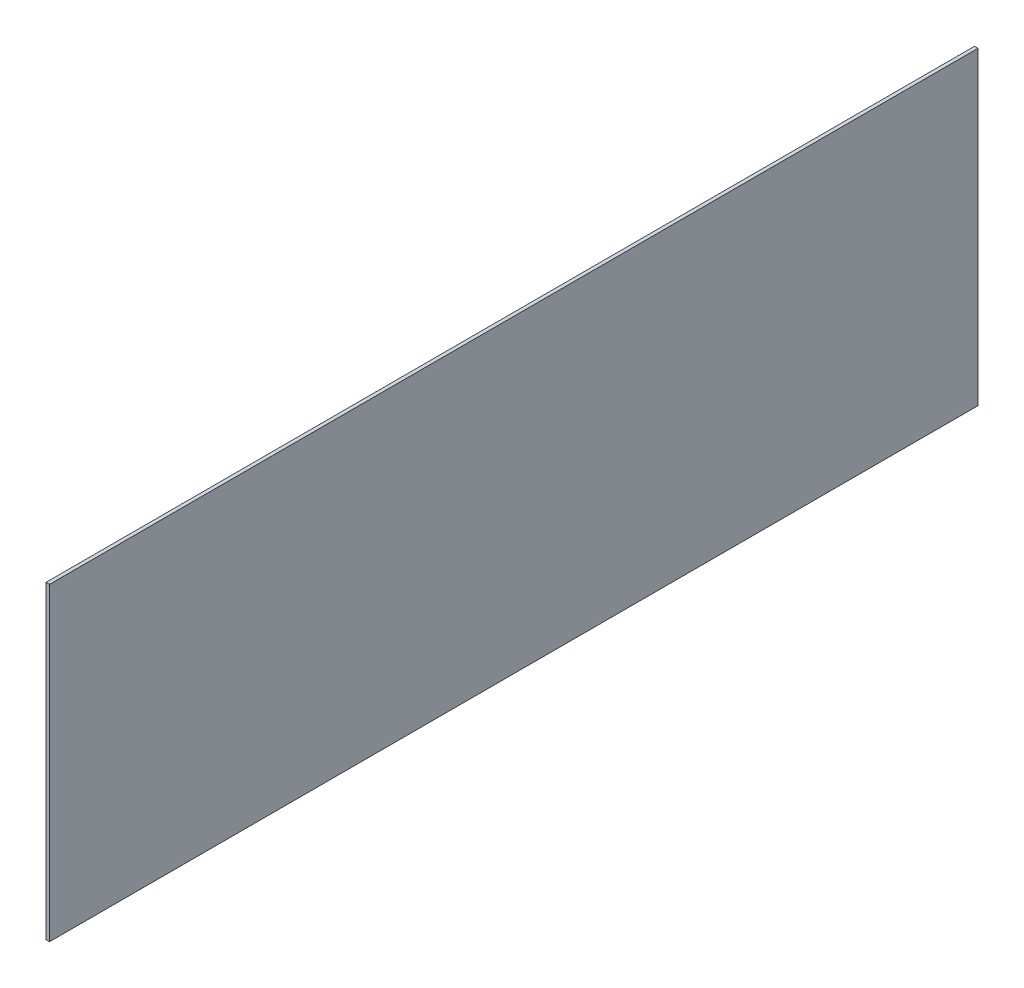
from build123d import *

# Parameters (mm, degrees)
SKETCH1_W           = 419.1
SKETCH1_H           = 139.7
BOSS_EXTRUDE1_DEPTH = 1.5875


with BuildPart() as part:
    # Sketch1 → Boss-Extrude1 (new body)
    with BuildSketch(Plane(origin=(0, 0, 0), x_dir=(0, 0, -1), z_dir=(1, 0, 0))):
        with Locations((209.55, 69.85)):
            Rectangle(SKETCH1_W, SKETCH1_H)
    extrude(amount=BOSS_EXTRUDE1_DEPTH)


solid = part.part
